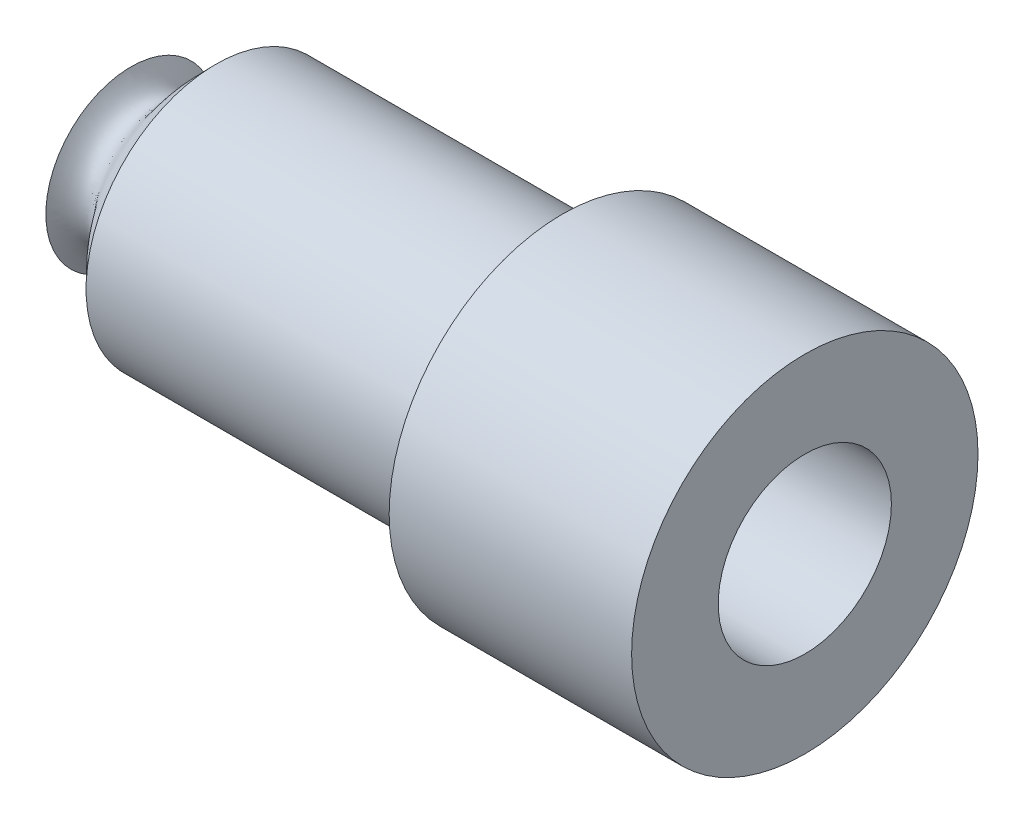
from build123d import *


with BuildPart() as part:
    # Sketch3 → Revolve1 (revolve)
    with BuildSketch(Plane(origin=(0, 0, 0), x_dir=(-1, 0, 0), z_dir=(0, 1, 0)), mode=Mode.PRIVATE) as revolve1_sk:
        with BuildLine():
            add(Edge.make_bspline(
                [(0, 7.5), (1.752854474, 5.664815439), (0.373820614, 7.240332376), (3.905572002, 2.879951334), (4.908772735, 4.915)],
                knots=[0, 0, 0, 0, 0.780983401, 1, 1, 1, 1], degree=3))
            Line((4.908772735, 4.915), (4.908772735, 0.915))
            Line((4.908772735, 0.915), (3.344098982, 0.778108784))
            ThreePointArc((3.344098982, 0.778108784), (3.040503625, 0.798007475), (2.756943239, 0.908278079))
            Line((2.756943239, 0.908278079), (0, 2.5))
            Line((0, 2.5), (-20, 2.5))
            Line((-20, 2.5), (-20, 5))
            Line((-20, 5), (-20, 7.5))
            Line((-20, 7.5), (0, 7.5))
        make_face()
        Polygon((-20, 10), (-20, 7.5), (-20, 5), (-34, 5), (-34, 10), align=None)
    revolve(revolve1_sk.sketch.rotate(Axis((0, 0, 0), (-1, 0, 0)), 180), axis=Axis((0, 0, 0), (-1, 0, 0)))


solid = part.part
